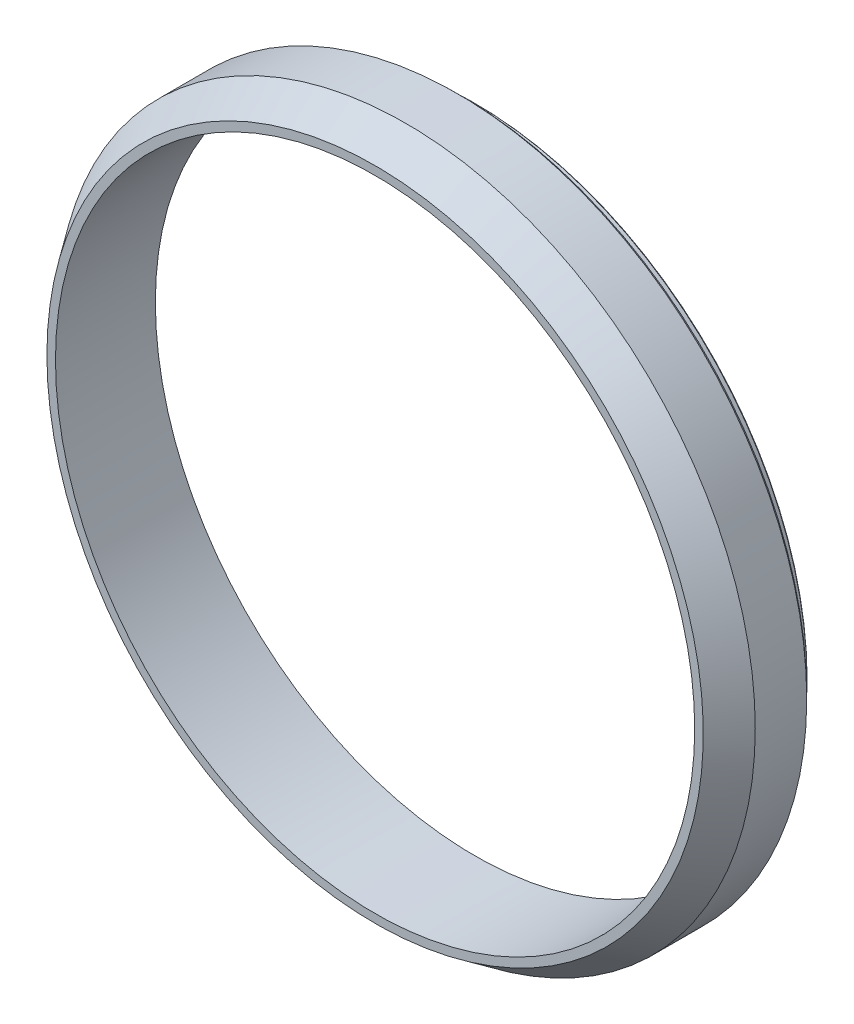
from build123d import *

# Parameters (mm, degrees)
CHAMFER1_SIZE  = 0.25
CHAMFER2_SIZE  = 0.5
CHAMFER3_SIZE  = 3
CHAMFER3_SIZE2 = 4.28444402


with BuildPart() as part:
    # Sketch2 → Revolve1 (revolve)
    with BuildSketch(Plane(origin=(0, 0, 0), x_dir=(1, 0, 0), z_dir=(0, 1, 0)), mode=Mode.PRIVATE) as revolve1_sk:
        Polygon((44.8, 14), (44.8, 0), (49, 0), (49, 12), (46.8, 12), (46.8, 14), align=None)
    revolve(revolve1_sk.sketch.rotate(Axis((0, 0, -51.275510204), (0, 0, 1)), 180), axis=Axis((0, 0, -51.275510204), (0, 0, 1)))

    # Chamfer1
    chamfer1_edges = [part.edges().sort_by_distance(p)[0] for p in [
        (46.8, 0, -14),
    ]]
    chamfer(chamfer1_edges, length=CHAMFER1_SIZE)

    # Chamfer2
    chamfer2_edges = [part.edges().sort_by_distance(p)[0] for p in [
        (49, 0, -12),
    ]]
    chamfer(chamfer2_edges, length=CHAMFER2_SIZE)

    # Chamfer3
    chamfer3_edges = [part.edges().sort_by_distance(p)[0] for p in [
        (49, 0, 0),
    ]]
    chamfer3_side = [part.faces().sort_by_distance(p)[0] for p in [
        (46.185929291, 0, 0),
    ]]
    chamfer(chamfer3_edges, length=CHAMFER3_SIZE, length2=CHAMFER3_SIZE2, reference=chamfer3_side[0])


solid = part.part
